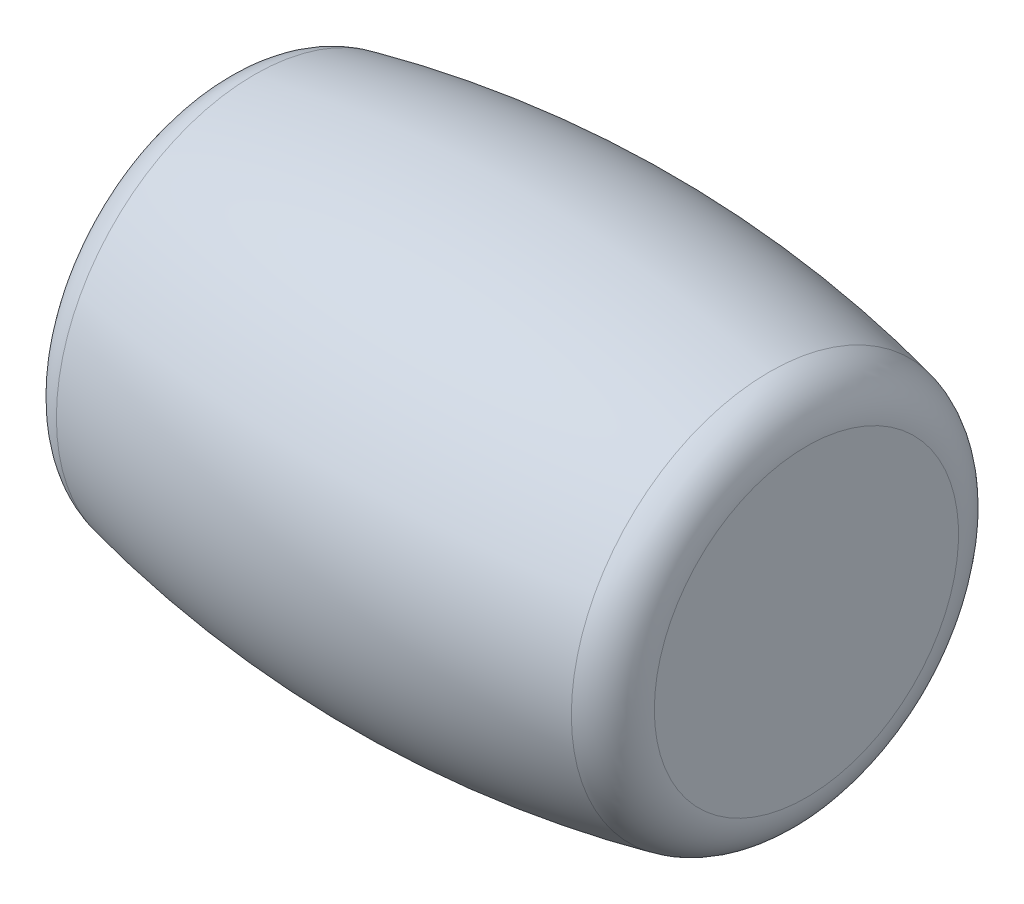
from build123d import *


with BuildPart() as part:
    # Sketch1 → Revolve1 (revolve)
    with BuildSketch(Plane.XY, mode=Mode.PRIVATE) as revolve1_sk:
        with BuildLine():
            Line((-6.25, 23.828501841), (-6.25, 20.6))
            Line((-6.25, 20.6), (6.25, 20.6))
            Line((6.25, 20.6), (6.25, 23.828501841))
            ThreePointArc((6.25, 23.828501841), (6.029475444, 24.454934625), (5.465163934, 24.805079786))
            ThreePointArc((5.465163934, 24.805079786), (0, 25.4), (-5.465163934, 24.805079786))
            ThreePointArc((-5.465163934, 24.805079786), (-6.029475444, 24.454934625), (-6.25, 23.828501841))
        make_face()
    revolve(revolve1_sk.sketch.rotate(Axis((-6.25, 20.6, 0), (1, 0, 0)), 90), axis=Axis((-6.25, 20.6, 0), (1, 0, 0)))


solid = part.part
